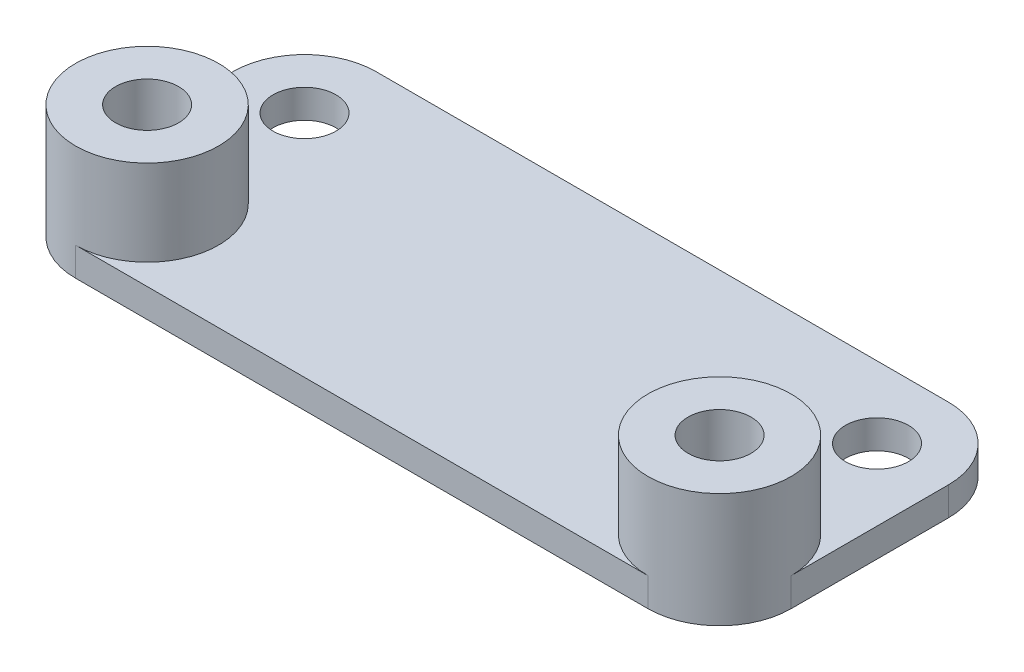
from build123d import *

# Parameters (mm, degrees)
SKETCH_1_R      = 2.2
EXTRUDE_1_DEPTH = 2
SKETCH_2_R      = 5
SKETCH_2_R_2    = 2.2
EXTRUDE_3_DEPTH = 6


with BuildPart() as part:
    # 草图1 → 凸台-拉伸1 (new body)
    with BuildSketch(Plane(origin=(0, 0, 0), x_dir=(1, 0, 0), z_dir=(0, 1, 0))):
        with BuildLine():
            Line((-20, 12.5), (20, 12.5))
            ThreePointArc((20, 12.5), (23.535533906, 11.035533906), (25, 7.5))
            Line((25, 7.5), (25, -3.5))
            ThreePointArc((25, -3.5), (23.535533906, -7.035533906), (20, -8.5))
            Line((20, -8.5), (-20, -8.5))
            ThreePointArc((-20, -8.5), (-23.535533906, -7.035533906), (-25, -3.5))
            Line((-25, -3.5), (-25, 7.5))
            ThreePointArc((-25, 7.5), (-23.535533906, 11.035533906), (-20, 12.5))
        make_face()
        with Locations(Location((20, 7.5, 0), (0, 0, 270))):
            Circle(SKETCH_1_R, mode=Mode.SUBTRACT)
        with Locations(Location((-20, 7.5, 0), (0, 0, 270))):
            Circle(SKETCH_1_R, mode=Mode.SUBTRACT)
        with Locations(Location((20, -3.5, 0), (0, 0, 270))):
            Circle(SKETCH_1_R, mode=Mode.SUBTRACT)
        with Locations(Location((-20, -3.5, 0), (0, 0, 270))):
            Circle(SKETCH_1_R, mode=Mode.SUBTRACT)
    extrude(amount=EXTRUDE_1_DEPTH)

    # 草图2 → 凸台-拉伸3 (add)
    # profile 1 of 2: a face of its own
    with BuildSketch(Plane(origin=(0, 2, 0), x_dir=(1, 0, 0), z_dir=(0, 1, 0))):
        with Locations(Location((-20, -3.5, 0), (0, 0, 270))):
            Circle(SKETCH_2_R)
        with Locations(Location((-20, -3.5, 0), (0, 0, 270))):
            Circle(SKETCH_2_R_2, mode=Mode.SUBTRACT)
    # profile 2 of 2: a face of its own
    with BuildSketch(Plane(origin=(0, 2, 0), x_dir=(1, 0, 0), z_dir=(0, 1, 0))):
        with Locations(Location((20, -3.5, 0), (0, 0, 270))):
            Circle(SKETCH_2_R)
        with Locations(Location((20, -3.5, 0), (0, 0, 270))):
            Circle(SKETCH_2_R_2, mode=Mode.SUBTRACT)
    extrude(amount=EXTRUDE_3_DEPTH)


solid = part.part
